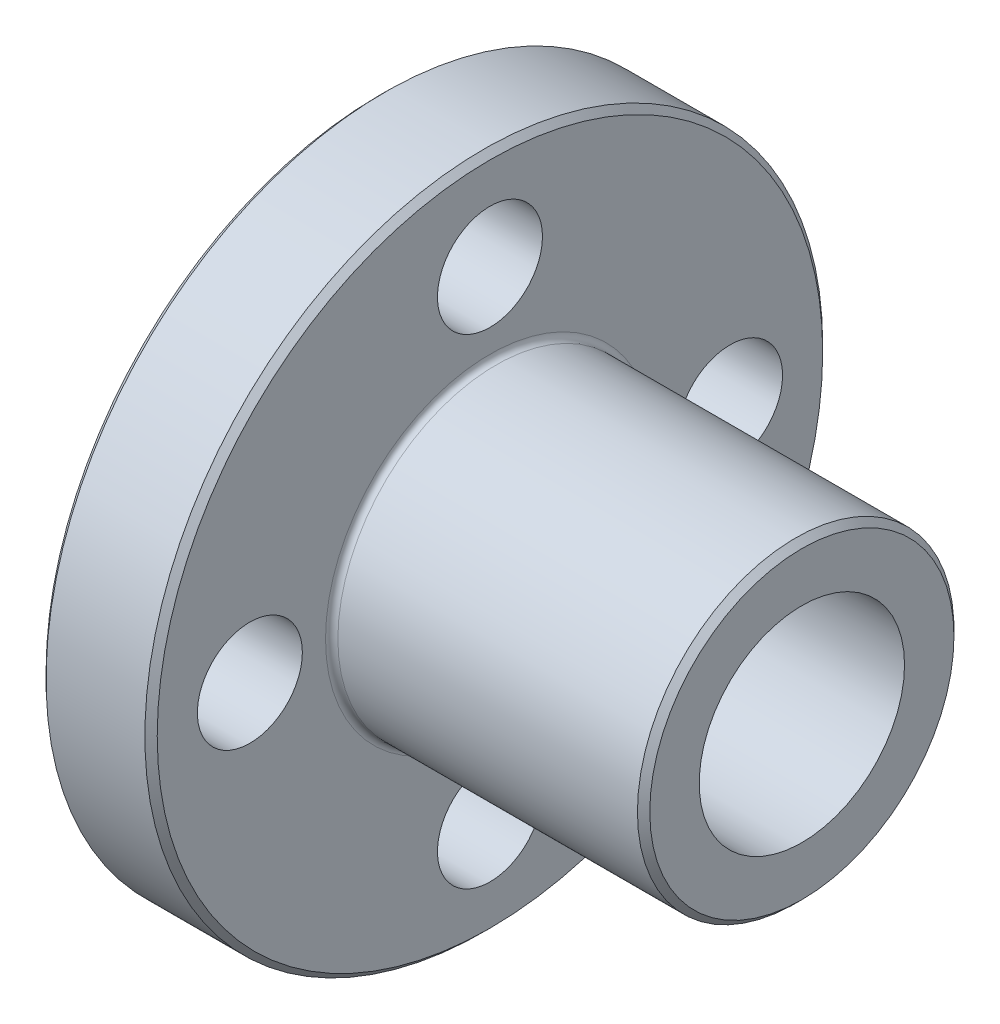
from build123d import *

# Parameters (mm, degrees)
SKETCH1_R                = 10.975
SKETCH1_R_2              = 1.7
BOSS_EXTRUDE1_DEPTH      = 3.6
SKETCH2_R                = 5.125
BOSS_EXTRUDE2_DEPTH      = 13.7
BOSS_EXTRUDE3_DEPTH      = 13.7
BOSS_EXTRUDE3_DEPTH_BACK = 1.3
SKETCH2_2_R              = 5.125
CUT_EXTRUDE1_DEPTH       = 21.702445508
CUT_EXTRUDE1_DEPTH_BACK  = 21.702445508
SKETCH3_R                = 3.325
FILLET1_R                = 0.2
CHAMFER1_SIZE            = 0.2


with BuildPart() as part:
    # Sketch1 → Boss-Extrude1 (new body)
    with BuildSketch(Plane(origin=(0, 0, 0), x_dir=(0, 0, -1), z_dir=(1, 0, 0))):
        Circle(SKETCH1_R)
        with Locations((0, 7.775)):
            Circle(SKETCH1_R_2, mode=Mode.SUBTRACT)
        with Locations((7.775, 0)):
            Circle(SKETCH1_R_2, mode=Mode.SUBTRACT)
        with Locations((0, -7.775)):
            Circle(SKETCH1_R_2, mode=Mode.SUBTRACT)
        with Locations((-7.775, 0)):
            Circle(SKETCH1_R_2, mode=Mode.SUBTRACT)
    extrude(amount=BOSS_EXTRUDE1_DEPTH)

    # Sketch2 → Boss-Extrude2 (add)
    with BuildSketch(Plane(origin=(0, 0, 0), x_dir=(0, 0, -1), z_dir=(1, 0, 0))):
        Circle(SKETCH2_R)
    extrude(amount=BOSS_EXTRUDE2_DEPTH)

    # Sketch2<2> → Boss-Extrude3 (add, two sides: drawn at the far end of the back side and taken through both)
    with BuildSketch(Plane(origin=(0, 0, 0), x_dir=(0, 0, -1), z_dir=(1, 0, 0)).offset(-BOSS_EXTRUDE3_DEPTH_BACK)):
        Circle(SKETCH2_2_R)
    extrude(amount=BOSS_EXTRUDE3_DEPTH + BOSS_EXTRUDE3_DEPTH_BACK)

    # Sketch3 → Cut-Extrude1 (cut, two sides: drawn at the far end of the back side and taken through both)
    with BuildSketch(Plane(origin=(0, 0, 0), x_dir=(0, 0, -1), z_dir=(1, 0, 0)).offset(-CUT_EXTRUDE1_DEPTH_BACK)):
        Circle(SKETCH3_R)
    extrude(amount=CUT_EXTRUDE1_DEPTH + CUT_EXTRUDE1_DEPTH_BACK, mode=Mode.SUBTRACT)

    # Fillet1
    fillet1_edges = [part.edges().sort_by_distance(p)[0] for p in [
        (3.6, 0, 5.125),
    ]]
    fillet(fillet1_edges, radius=FILLET1_R)

    # Chamfer1
    chamfer1_edges = [part.edges().sort_by_distance(p)[0] for p in [
        (13.7, 0, 5.125),
        (0, 0, 10.975),
        (3.6, 0, 10.975),
    ]]
    chamfer(chamfer1_edges, length=CHAMFER1_SIZE)


solid = part.part
